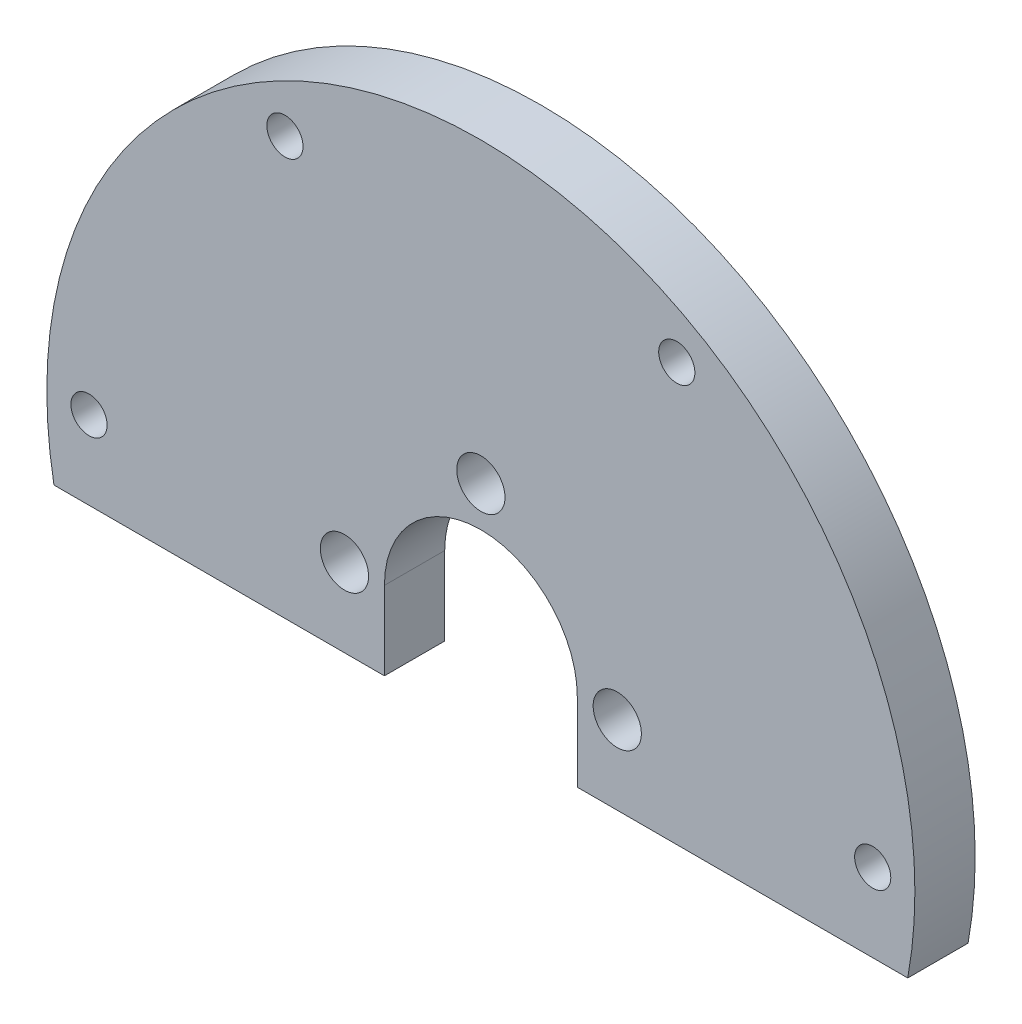
from build123d import *

# Parameters (mm, degrees)
SKETCH1_R           = 1.5
SKETCH1_R_2         = 2
BOSS_EXTRUDE1_DEPTH = 5


with BuildPart() as part:
    # Sketch1 → Boss-Extrude1 (new body)
    with BuildSketch(Plane.XY):
        with BuildLine():
            ThreePointArc((35.408332353, -6.5), (0, 36), (-35.408332353, -6.5))
            Line((-35.408332353, -6.5), (-7.998604295, -6.5))
            Line((-7.998604295, -6.5), (-7.998604295, 0))
            ThreePointArc((-7.998604295, 0), (0, 7.998604295), (7.998604295, 0))
            Line((7.998604295, 0), (7.998604295, -6.5))
            Line((7.998604295, -6.5), (35.408332353, -6.5))
        make_face()
        with Locations((-32.5, 0)):
            Circle(SKETCH1_R, mode=Mode.SUBTRACT)
        with Locations((-11.313708499, 0)):
            Circle(SKETCH1_R_2, mode=Mode.SUBTRACT)
        with Locations((0, 11.313708499)):
            Circle(SKETCH1_R_2, mode=Mode.SUBTRACT)
        with Locations((11.313708499, 0)):
            Circle(SKETCH1_R_2, mode=Mode.SUBTRACT)
        with Locations((32.5, 0)):
            Circle(SKETCH1_R, mode=Mode.SUBTRACT)
        with Locations((-16.25, 28.145825623)):
            Circle(SKETCH1_R, mode=Mode.SUBTRACT)
        with Locations((16.25, 28.145825623)):
            Circle(SKETCH1_R, mode=Mode.SUBTRACT)
    extrude(amount=BOSS_EXTRUDE1_DEPTH)


solid = part.part
